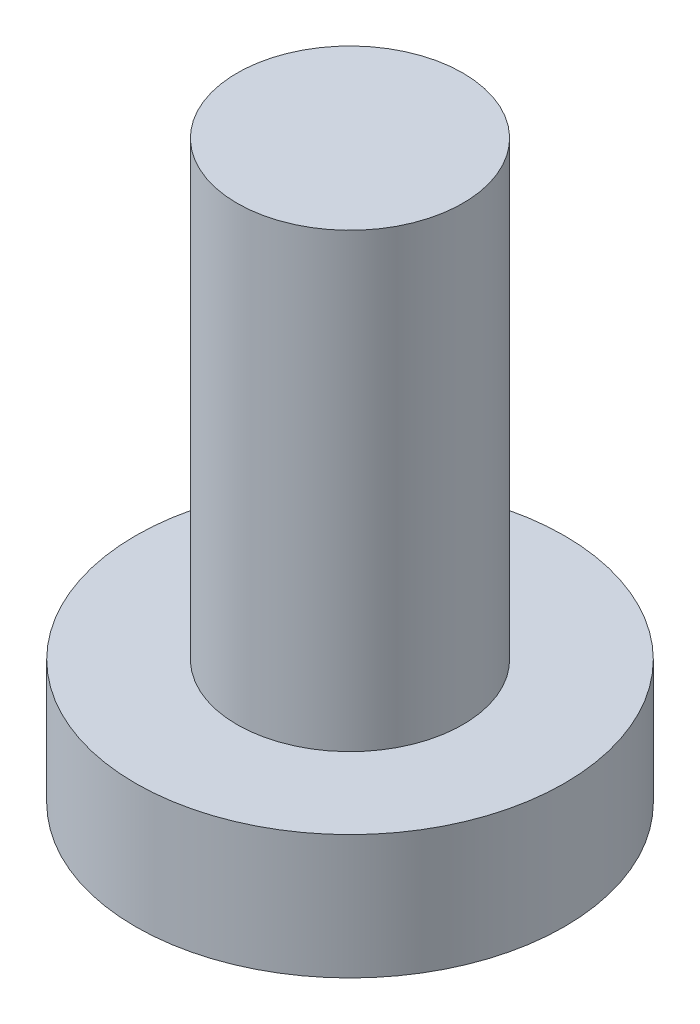
from build123d import *

# Parameters (mm, degrees)
SKETCH_1_R      = 2.85
EXTRUDE_1_DEPTH = 1.65
SKETCH_2_R      = 1.5
EXTRUDE_2_DEPTH = 6


with BuildPart() as part:
    # 草图1 → 凸台-拉伸1 (new body)
    with BuildSketch(Plane(origin=(0, 0, 0), x_dir=(1, 0, 0), z_dir=(0, 1, 0))):
        with Locations(Location((0, 0, 0), (0, 0, 270))):
            Circle(SKETCH_1_R)
    extrude(amount=EXTRUDE_1_DEPTH)

    # 草图2 → 凸台-拉伸2 (add)
    with BuildSketch(Plane(origin=(0, 1.65, 0), x_dir=(1, 0, 0), z_dir=(0, 1, 0))):
        with Locations(Location((0, 0, 0), (0, 0, 270))):
            Circle(SKETCH_2_R)
    extrude(amount=EXTRUDE_2_DEPTH)


solid = part.part
